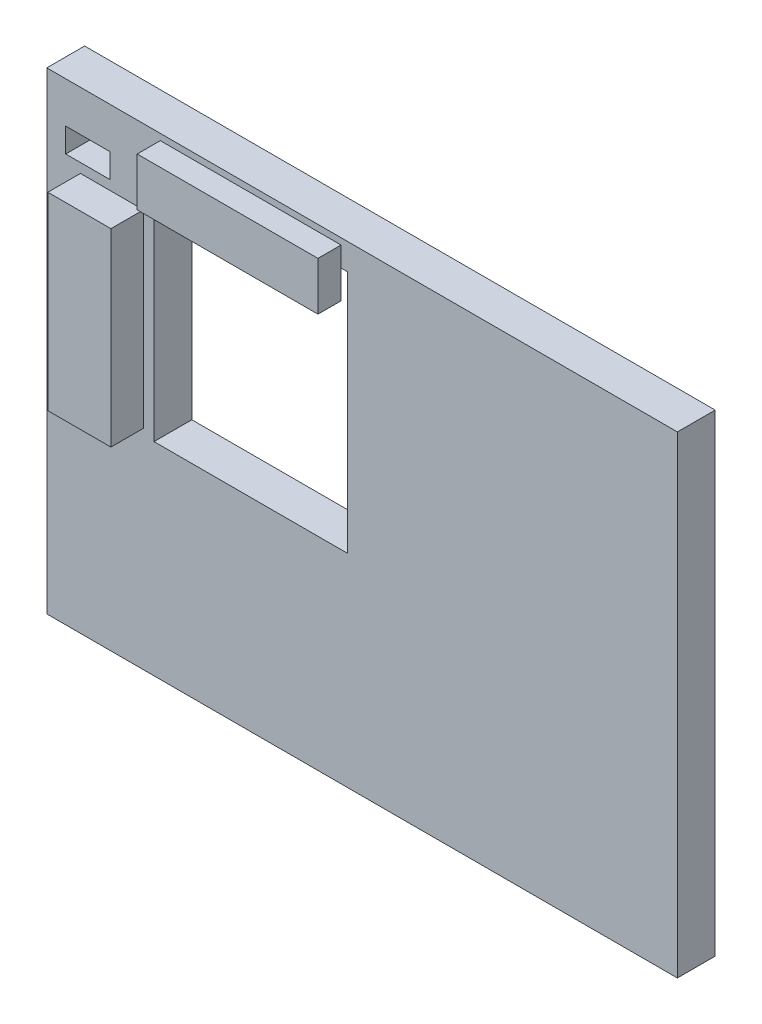
from build123d import *

# Parameters (mm, degrees)
SKETCH1_W           = 3000
SKETCH1_H           = 2250
SKETCH1_W_2         = 210
SKETCH1_H_2         = 115
SKETCH1_W_3         = 920
SKETCH1_H_3         = 1160
BOSS_EXTRUDE1_DEPTH = 180
SKETCH2_W           = 300
SKETCH2_H           = 900
BOSS_EXTRUDE2_DEPTH = 155
SKETCH3_W           = 860
SKETCH3_H           = 230
BOSS_EXTRUDE3_DEPTH = 110


with BuildPart() as part:
    # Sketch1 → Boss-Extrude1 (new body)
    with BuildSketch(Plane.XY):
        with Locations((66.706806947, -350.280539566)):
            Rectangle(SKETCH1_W, SKETCH1_H)
        with Locations((-1238.293193053, 522.219460434)):
            Rectangle(SKETCH1_W_2, SKETCH1_H_2, mode=Mode.SUBTRACT)
        with Locations((-463.293193053, 69.719460434)):
            Rectangle(SKETCH1_W_3, SKETCH1_H_3, mode=Mode.SUBTRACT)
    extrude(amount=BOSS_EXTRUDE1_DEPTH)

    # Sketch2 → Boss-Extrude2 (add)
    with BuildSketch(Plane.XY.offset(180)):
        with Locations((-1123.293193053, -30.280539566)):
            Rectangle(SKETCH2_W, SKETCH2_H)
    extrude(amount=BOSS_EXTRUDE2_DEPTH)

    # Sketch3 → Boss-Extrude3 (add)
    with BuildSketch(Plane.XY.offset(180)):
        with Locations((-463.293193053, 629.719460434)):
            Rectangle(SKETCH3_W, SKETCH3_H)
    extrude(amount=BOSS_EXTRUDE3_DEPTH)


solid = part.part
